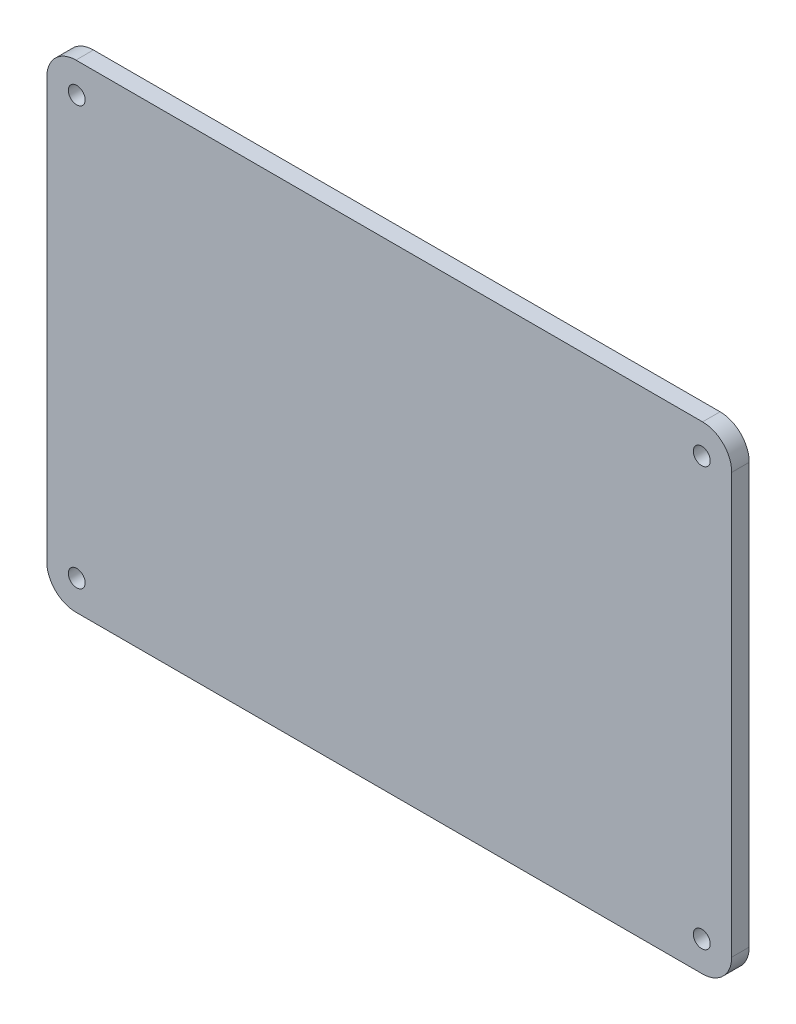
from build123d import *

# Parameters (mm, degrees)
BOSS_EXTRUDE1_DEPTH    = 3
M2_5_CLEARANCE_HOLE1_D = 2.9


with BuildPart() as part:
    # Sketch1 → Boss-Extrude1 (new body)
    with BuildSketch(Plane.XY):
        with BuildLine():
            Line((-700.529573216, 908.661404475), (-593.069773216, 908.661404475))
            ThreePointArc((-593.069773216, 908.661404475), (-589.53423931, 907.19693838), (-588.069773216, 903.661404475))
            Line((-588.069773216, 903.661404475), (-588.069773216, 831.660004475))
            ThreePointArc((-588.069773216, 831.660004475), (-589.53423931, 828.124470569), (-593.069773216, 826.660004475))
            Line((-593.069773216, 826.660004475), (-700.529573216, 826.660004475))
            ThreePointArc((-700.529573216, 826.660004475), (-704.065107121, 828.124470569), (-705.529573216, 831.660004475))
            Line((-705.529573216, 831.660004475), (-705.529573216, 903.661404475))
            ThreePointArc((-705.529573216, 903.661404475), (-704.065107121, 907.19693838), (-700.529573216, 908.661404475))
        make_face()
    extrude(amount=BOSS_EXTRUDE1_DEPTH)

    # M2.5 Clearance Hole1 (through all)
    with Locations(Plane.XY.offset(3)):
        with Locations((-700.393534246, 903.525365505), (-593.205812185, 903.525365505), (-593.205812185, 831.796043444), (-700.393534246, 831.796043444)):
            Hole(M2_5_CLEARANCE_HOLE1_D / 2)


solid = part.part
